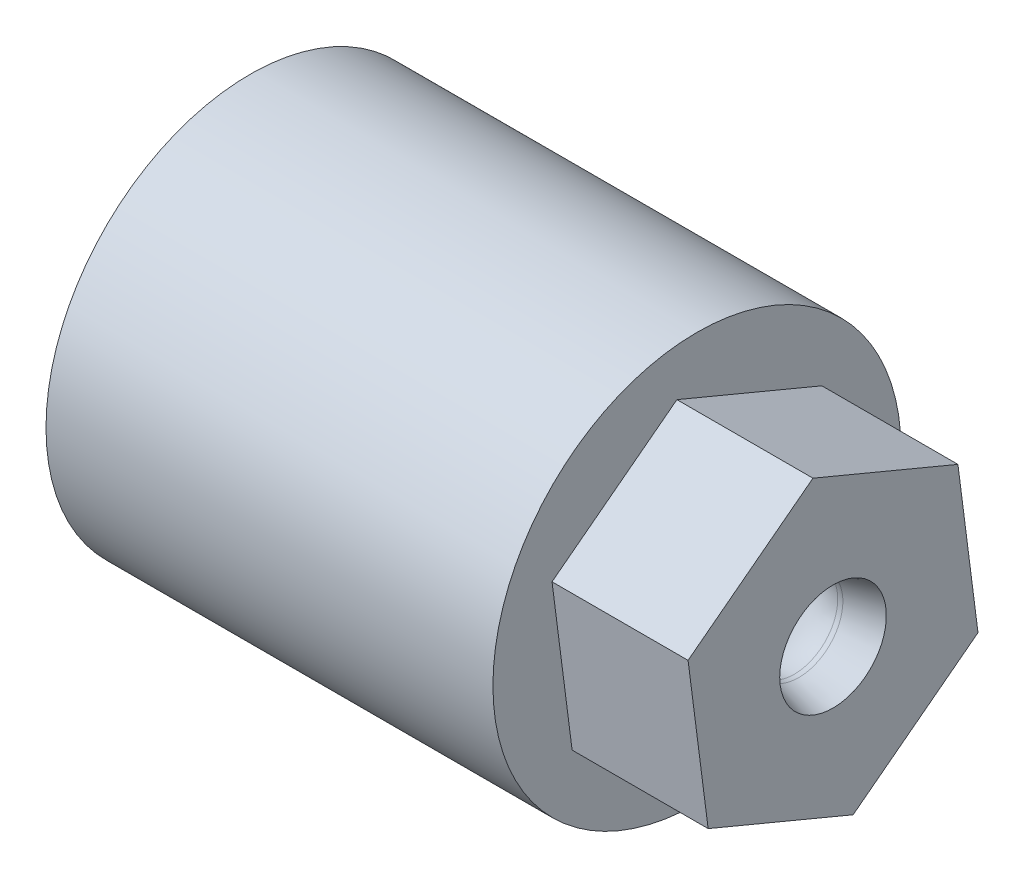
from build123d import *

# Parameters (mm, degrees)
CUT_EXTRUDE2_START = -6.35
SKETCH3_R          = 9.525
CUT_EXTRUDE2_DEPTH = 6.35


with BuildPart() as part:
    # Sketch1 → Revolve1 (revolve)
    with BuildSketch(Plane.XY, mode=Mode.PRIVATE) as revolve1_sk:
        with BuildLine():
            Line((0.21036812, 2.059695488), (1.811366005, 2.488681579))
            Line((1.811366005, 2.488681579), (1.811366005, 9.525))
            Line((1.811366005, 9.525), (-10.888633995, 9.525))
            Line((-10.888633995, 9.525), (-25.4, 9.525))
            Line((-25.4, 9.525), (-25.4, 5.747363917))
            Line((-25.4, 5.747363917), (-6.293014916, 5.747363917))
            ThreePointArc((-6.293014916, 5.747363917), (-5.077995018, 5.505681433), (-4.047950886, 4.817427948))
            Line((-4.047950886, 4.817427948), (-2.155261469, 2.924738531))
            ThreePointArc((-2.155261469, 2.924738531), (-1.166419102, 2.264015185), (0, 2.032))
            ThreePointArc((0, 2.032), (0.106091689, 2.038953617), (0.21036812, 2.059695488))
        make_face()
    revolve(revolve1_sk.sketch.rotate(Axis((0, 0, 0), (1, 0, 0)), 90), axis=Axis((0, 0, 0), (1, 0, 0)))

    # Sketch3 → Cut-Extrude2 (cut)
    with BuildSketch(Plane(origin=(1.811366005, 0, 0), x_dir=(0, 0, -1), z_dir=(1, 0, 0)).offset(CUT_EXTRUDE2_START)):
        with Locations(Location((0, 0, 0), (0, 0, 180))):
            Circle(SKETCH3_R)
        Polygon((-5.829170486, -4.447932641), (0.937437419, -7.272176044), (6.766607905, -2.824243403), (5.829170486, 4.447932641), (-0.937437419, 7.272176044), (-6.766607905, 2.824243403), align=None, mode=Mode.SUBTRACT)
    extrude(amount=CUT_EXTRUDE2_DEPTH, mode=Mode.SUBTRACT)


solid = part.part
